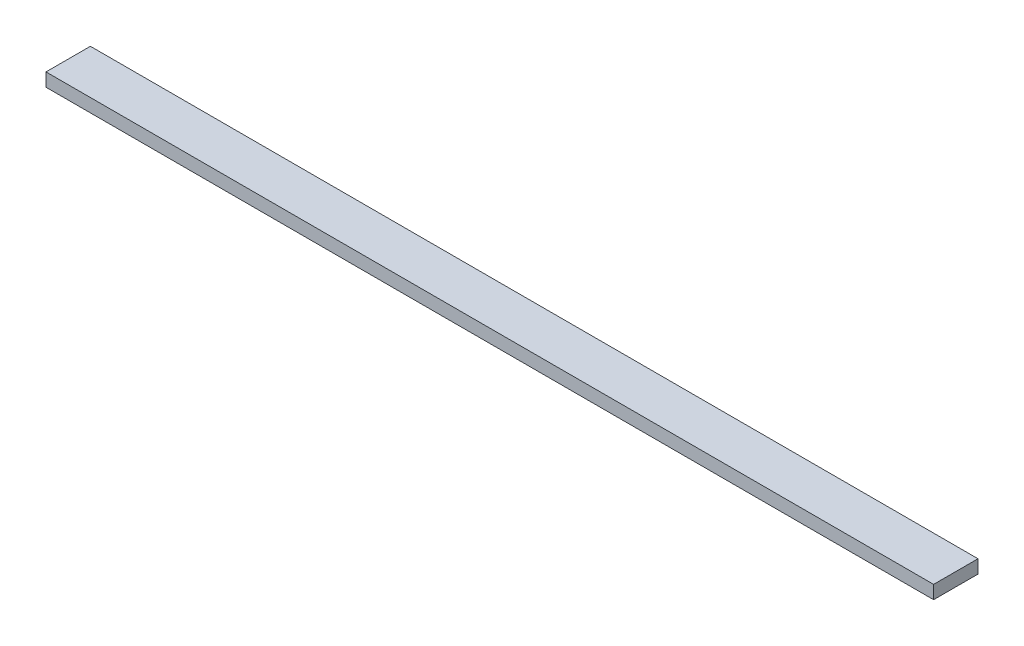
from build123d import *

# Parameters (mm, degrees)
SKETCH1_W           = 200
SKETCH1_H           = 10
BOSS_EXTRUDE1_DEPTH = 1.5


with BuildPart() as part:
    # Sketch1 → Boss-Extrude1 (new, symmetric)
    with BuildSketch(Plane(origin=(0, 0, 0), x_dir=(1, 0, 0), z_dir=(0, 1, 0))):
        Rectangle(SKETCH1_W, SKETCH1_H)
    extrude(amount=BOSS_EXTRUDE1_DEPTH, both=True)


solid = part.part
